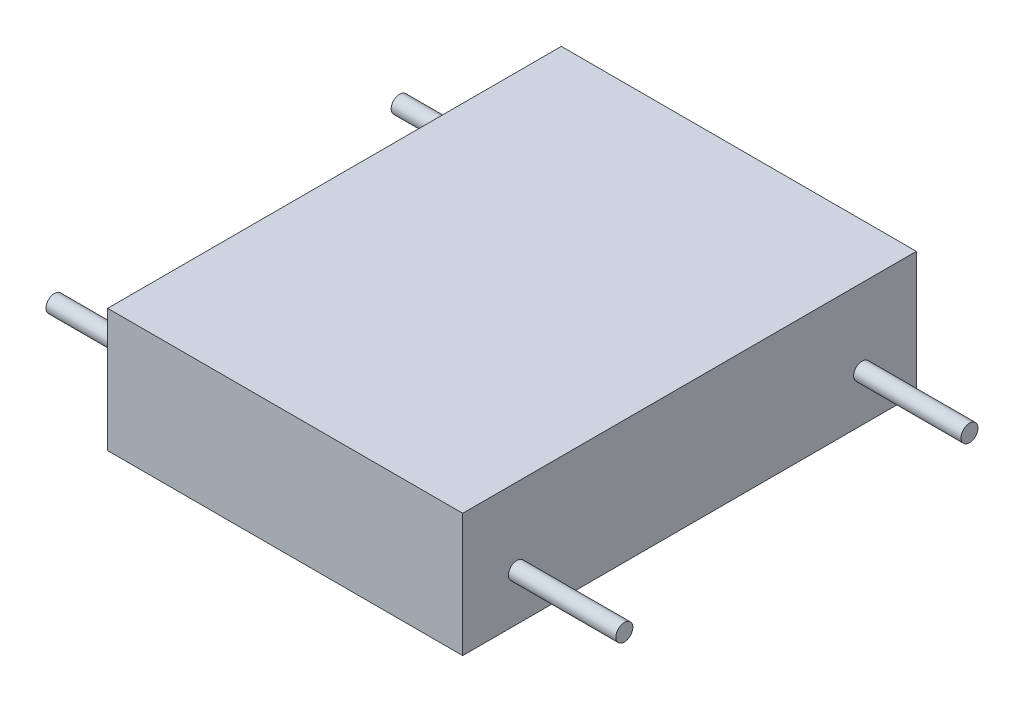
from build123d import *

# Parameters (mm, degrees)
SKETCH_1_W                                 = 144
SKETCH_1_H                                 = 184
EXTRUDE_1_DEPTH                            = 50
SKETCH_2_R                                 = 3.45
EXTRUDE_2_DEPTH                            = 43.56
MIRROR_1_AT_THE_SECOND_PLANE_COPY_1_SKET_R = 3.45
MIRROR_1_AT_THE_SECOND_PLANE_COPY_1_DEPTH  = 43.56


with BuildPart() as part:
    # 草图1 → 凸台-拉伸1 (new body)
    with BuildSketch(Plane(origin=(0, 0, 0), x_dir=(1, 0, 0), z_dir=(0, 1, 0))):
        with Locations((-0.153518124, -55.002132196)):
            Rectangle(SKETCH_1_W, SKETCH_1_H)
    extrude(amount=EXTRUDE_1_DEPTH)

    # 草图2 → 凸台-拉伸2 (add)
    with BuildSketch(Plane.ZY.offset(72.153518124)):
        with Locations((-14.997867804, 19)):
            Circle(SKETCH_2_R)
    extrude_2 = extrude(amount=EXTRUDE_2_DEPTH)

    # 镜向1: 凸台-拉伸2 across plane
    add(extrude_2.mirror(Plane.ZY.offset(0.153518124)))

    # 镜向1 at the second plane: 凸台-拉伸2 across plane
    add(extrude_2.mirror(Plane(origin=(0, 0, 55.002132196), x_dir=(1, 0, 0), z_dir=(0, 0, -1))))

    # 镜向1 at the second plane copy 1 sket → 镜向1 at the second plane copy 1 (add)
    with BuildSketch(Plane(origin=(71.846481876, 0, 110.004264392), x_dir=(0, 0, -1), z_dir=(1, 0, 0))):
        with Locations((-14.997867804, 19)):
            Circle(MIRROR_1_AT_THE_SECOND_PLANE_COPY_1_SKET_R)
    extrude(amount=MIRROR_1_AT_THE_SECOND_PLANE_COPY_1_DEPTH)


solid = part.part
